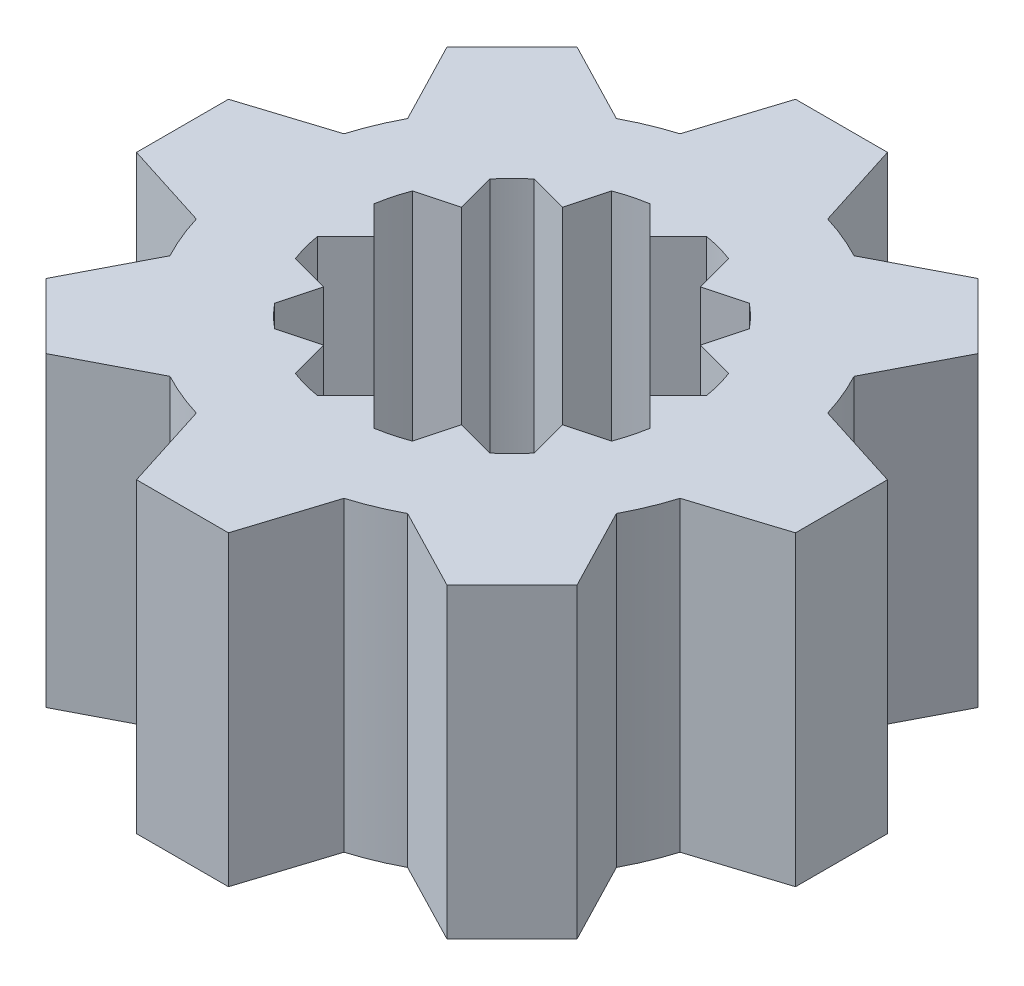
from build123d import *

# Parameters (mm, degrees)
BOSS_EXTRUDE1_DEPTH = 10


with BuildPart() as part:
    # Sketch1 → Boss-Extrude1 (new body)
    with BuildSketch(Plane(origin=(0, 0, 0), x_dir=(1, 0, 0), z_dir=(0, 1, 0))):
        with BuildLine():
            Line((-1.5, 10.75), (1.5, 10.75))
            Line((1.5, 10.75), (2.408073523, 7.890733927))
            ThreePointArc((2.408073523, 7.890733927), (3.157138317, 7.622006143), (3.87682635, 7.282356586))
            Line((3.87682635, 7.282356586), (6.540737726, 8.66205807))
            Line((6.540737726, 8.66205807), (8.66205807, 6.540737726))
            Line((8.66205807, 6.540737726), (7.282356586, 3.87682635))
            ThreePointArc((7.282356586, 3.87682635), (7.622006143, 3.157138317), (7.890733927, 2.408073523))
            Line((7.890733927, 2.408073523), (10.75, 1.5))
            Line((10.75, 1.5), (10.75, -1.5))
            Line((10.75, -1.5), (7.890733927, -2.408073523))
            ThreePointArc((7.890733927, -2.408073523), (7.622006143, -3.157138317), (7.282356586, -3.87682635))
            Line((7.282356586, -3.87682635), (8.66205807, -6.540737726))
            Line((8.66205807, -6.540737726), (6.540737726, -8.66205807))
            Line((6.540737726, -8.66205807), (3.87682635, -7.282356586))
            ThreePointArc((3.87682635, -7.282356586), (3.157138317, -7.622006143), (2.408073523, -7.890733927))
            Line((2.408073523, -7.890733927), (1.5, -10.75))
            Line((1.5, -10.75), (-1.5, -10.75))
            Line((-1.5, -10.75), (-2.408073523, -7.890733927))
            ThreePointArc((-2.408073523, -7.890733927), (-3.157138317, -7.622006143), (-3.87682635, -7.282356586))
            Line((-3.87682635, -7.282356586), (-6.540737726, -8.66205807))
            Line((-6.540737726, -8.66205807), (-8.66205807, -6.540737726))
            Line((-8.66205807, -6.540737726), (-7.282356586, -3.87682635))
            ThreePointArc((-7.282356586, -3.87682635), (-7.622006143, -3.157138317), (-7.890733927, -2.408073523))
            Line((-7.890733927, -2.408073523), (-10.75, -1.5))
            Line((-10.75, -1.5), (-10.75, 1.5))
            Line((-10.75, 1.5), (-7.890733927, 2.408073523))
            ThreePointArc((-7.890733927, 2.408073523), (-7.622006143, 3.157138317), (-7.282356586, 3.87682635))
            Line((-7.282356586, 3.87682635), (-8.66205807, 6.540737726))
            Line((-8.66205807, 6.540737726), (-6.540737726, 8.66205807))
            Line((-6.540737726, 8.66205807), (-3.87682635, 7.282356586))
            ThreePointArc((-3.87682635, 7.282356586), (-3.157138317, 7.622006143), (-2.408073523, 7.890733927))
            Line((-2.408073523, 7.890733927), (-1.5, 10.75))
        make_face()
        with BuildLine():
            Line((0, 4.5), (-0.922144385, 5.422144385))
            ThreePointArc((-0.922144385, 5.422144385), (-1.423504748, 5.312592045), (-1.912471729, 5.156786973))
            Line((-1.912471729, 5.156786973), (-2.25, 3.897114317))
            Line((-2.25, 3.897114317), (-3.509672656, 4.234642588))
            ThreePointArc((-3.509672656, 4.234642588), (-3.889087297, 3.889087297), (-4.234642588, 3.509672656))
            Line((-4.234642588, 3.509672656), (-3.897114317, 2.25))
            Line((-3.897114317, 2.25), (-5.156786973, 1.912471729))
            ThreePointArc((-5.156786973, 1.912471729), (-5.312592045, 1.423504748), (-5.422144385, 0.922144385))
            Line((-5.422144385, 0.922144385), (-4.5, 0))
            Line((-4.5, 0), (-5.422144385, -0.922144385))
            ThreePointArc((-5.422144385, -0.922144385), (-5.312592045, -1.423504748), (-5.156786973, -1.912471729))
            Line((-5.156786973, -1.912471729), (-3.897114317, -2.25))
            Line((-3.897114317, -2.25), (-4.234642588, -3.509672656))
            ThreePointArc((-4.234642588, -3.509672656), (-3.889087297, -3.889087297), (-3.509672656, -4.234642588))
            Line((-3.509672656, -4.234642588), (-2.25, -3.897114317))
            Line((-2.25, -3.897114317), (-1.912471729, -5.156786973))
            ThreePointArc((-1.912471729, -5.156786973), (-1.423504748, -5.312592045), (-0.922144385, -5.422144385))
            Line((-0.922144385, -5.422144385), (0, -4.5))
            Line((0, -4.5), (0.922144385, -5.422144385))
            ThreePointArc((0.922144385, -5.422144385), (1.423504748, -5.312592045), (1.912471729, -5.156786973))
            Line((1.912471729, -5.156786973), (2.25, -3.897114317))
            Line((2.25, -3.897114317), (3.509672656, -4.234642588))
            ThreePointArc((3.509672656, -4.234642588), (3.889087297, -3.889087297), (4.234642588, -3.509672656))
            Line((4.234642588, -3.509672656), (3.897114317, -2.25))
            Line((3.897114317, -2.25), (5.156786973, -1.912471729))
            ThreePointArc((5.156786973, -1.912471729), (5.312592045, -1.423504748), (5.422144385, -0.922144385))
            Line((5.422144385, -0.922144385), (4.5, 0))
            Line((4.5, 0), (5.422144385, 0.922144385))
            ThreePointArc((5.422144385, 0.922144385), (5.312592045, 1.423504748), (5.156786973, 1.912471729))
            Line((5.156786973, 1.912471729), (3.897114317, 2.25))
            Line((3.897114317, 2.25), (4.234642588, 3.509672656))
            ThreePointArc((4.234642588, 3.509672656), (3.889087297, 3.889087297), (3.509672656, 4.234642588))
            Line((3.509672656, 4.234642588), (2.25, 3.897114317))
            Line((2.25, 3.897114317), (1.912471729, 5.156786973))
            ThreePointArc((1.912471729, 5.156786973), (1.423504748, 5.312592045), (0.922144385, 5.422144385))
            Line((0.922144385, 5.422144385), (0, 4.5))
        make_face(mode=Mode.SUBTRACT)
    extrude(amount=BOSS_EXTRUDE1_DEPTH)


solid = part.part
